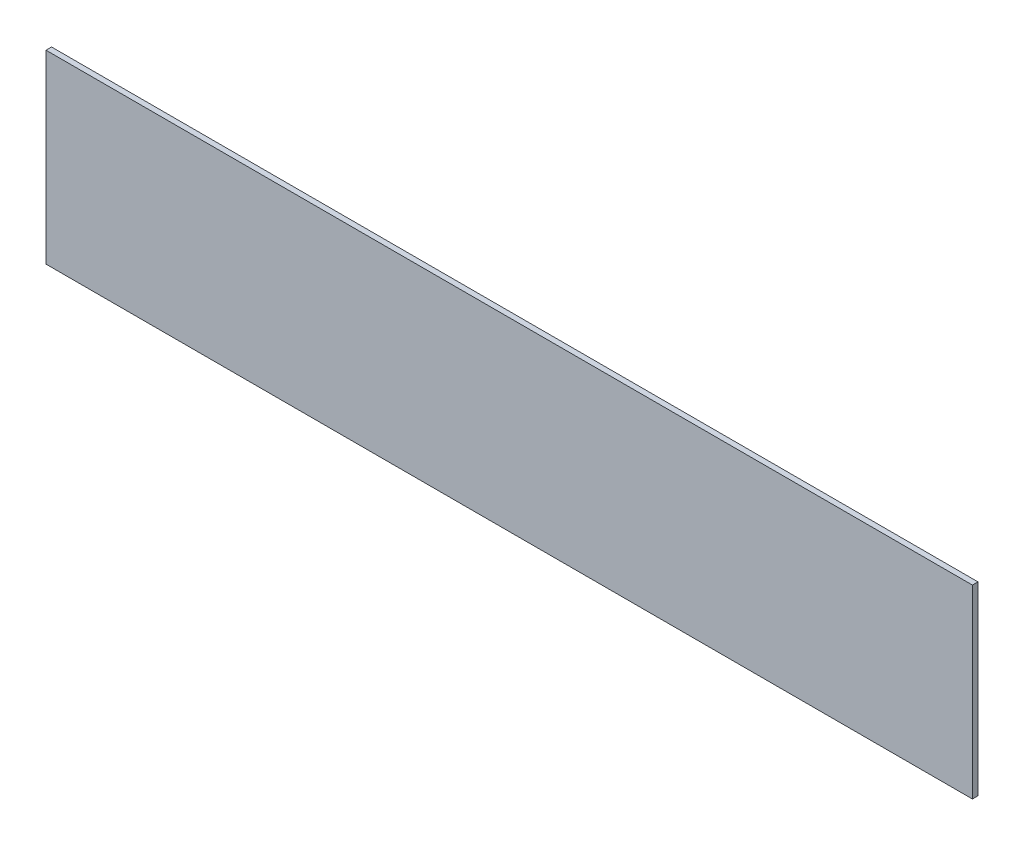
from build123d import *

# Parameters (mm, degrees)
SKETCH_1_W               = 100
SKETCH_1_H               = 20
EXTRUDE_100_20_0_6_DEPTH = 0.6


with BuildPart() as part:
    # Эскиз1 → 100/20/0,6 (new body)
    with BuildSketch(Plane.XY):
        with Locations((50, 10)):
            Rectangle(SKETCH_1_W, SKETCH_1_H)
    extrude(amount=EXTRUDE_100_20_0_6_DEPTH)


solid = part.part
